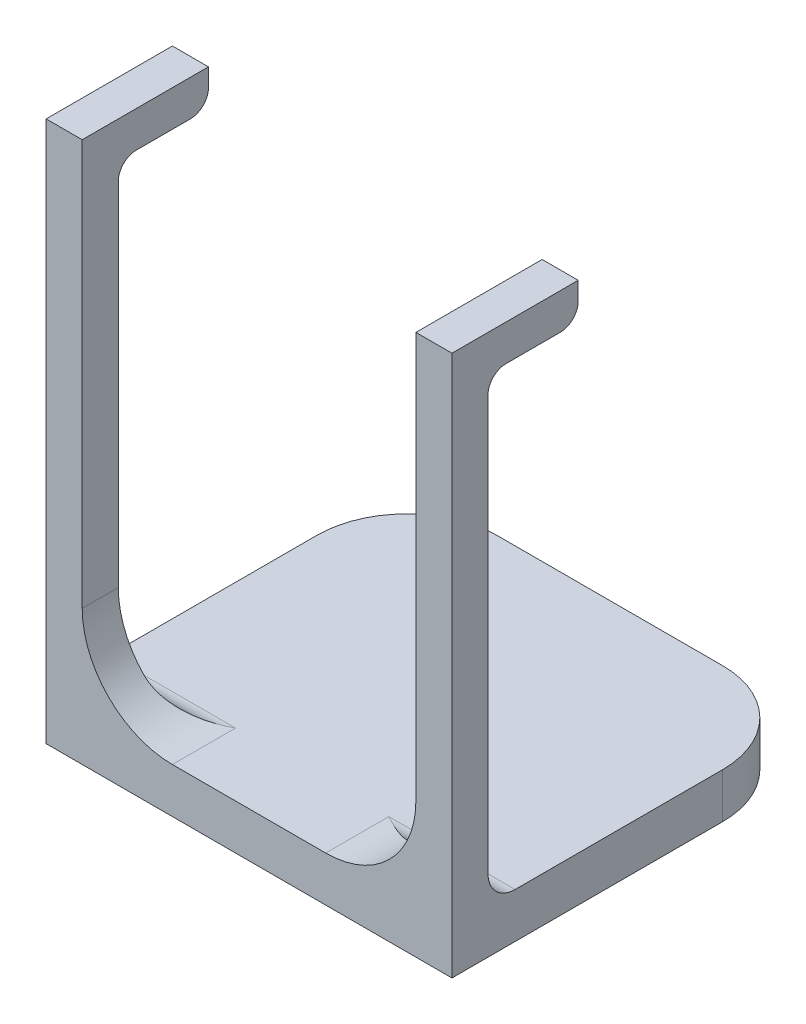
from build123d import *

# Parameters (mm, degrees)
SKETCH1_W           = 45
SKETCH1_H           = 40
BOSS_EXTRUDE1_DEPTH = 5
SKETCH2_R           = 12.7
CUT_EXTRUDE1_DEPTH  = 3.2
SKETCH3_W           = 4
SKETCH3_H           = 4
BOSS_EXTRUDE2_DEPTH = 55
SKETCH4_W           = 4
SKETCH4_H           = 4
BOSS_EXTRUDE3_DEPTH = 10
FILLET1_R           = 10
FILLET2_R           = 2
FILLET3_R           = 3
FILLET4_R           = 10


with BuildPart() as part:
    # Sketch1 → Boss-Extrude1 (new body)
    with BuildSketch(Plane(origin=(0, 0, 0), x_dir=(1, 0, 0), z_dir=(0, 1, 0))):
        Rectangle(SKETCH1_W, SKETCH1_H)
    extrude(amount=BOSS_EXTRUDE1_DEPTH)

    # Sketch2 → Cut-Extrude1 (cut)
    with BuildSketch(Plane(origin=(0, 0, 0), x_dir=(-1, 0, 0), z_dir=(0, -1, 0))):
        with Locations(Location((0, 0, 0), (0, 0, 90))):
            Circle(SKETCH2_R)
    extrude(amount=-CUT_EXTRUDE1_DEPTH, mode=Mode.SUBTRACT)

    # Sketch3 → Boss-Extrude2 (add)
    with BuildSketch(Plane(origin=(0, 5, 0), x_dir=(1, 0, 0), z_dir=(0, 1, 0))):
        with Locations((-20.5, -18)):
            Rectangle(SKETCH3_W, SKETCH3_H)
        with Locations((20.5, -18)):
            Rectangle(SKETCH3_W, SKETCH3_H)
    extrude(amount=BOSS_EXTRUDE2_DEPTH)

    # Sketch4 → Boss-Extrude3 (add)
    with BuildSketch(Plane(origin=(0, 0, 16), x_dir=(-1, 0, 0), z_dir=(0, 0, -1))):
        with Locations((20.5, 58)):
            Rectangle(SKETCH4_W, SKETCH4_H)
        with Locations((-20.5, 58)):
            Rectangle(SKETCH4_W, SKETCH4_H)
    extrude(amount=BOSS_EXTRUDE3_DEPTH)

    # Fillet1
    fillet1_edges = [part.edges().sort_by_distance(p)[0] for p in [
        (-18.5, 5, 18),
        (18.5, 5, 18),
    ]]
    fillet(fillet1_edges, radius=FILLET1_R)

    # Fillet2
    fillet2_edges = [part.edges().sort_by_distance(p)[0] for p in [
        (-20.5, 56, 16),
        (-20.5, 56, 6),
        (20.5, 56, 16),
        (20.5, 56, 6),
    ]]
    fillet(fillet2_edges, radius=FILLET2_R)

    # Fillet3
    fillet3_edges = [part.edges().sort_by_distance(p)[0] for p in [
        (-15.5, 5, 16),
        (15.5, 5, 16),
    ]]
    fillet(fillet3_edges, radius=FILLET3_R)

    # Fillet4
    fillet4_edges = [part.edges().sort_by_distance(p)[0] for p in [
        (-22.5, 2.5, -20),
        (22.5, 2.5, -20),
    ]]
    fillet(fillet4_edges, radius=FILLET4_R)


solid = part.part
